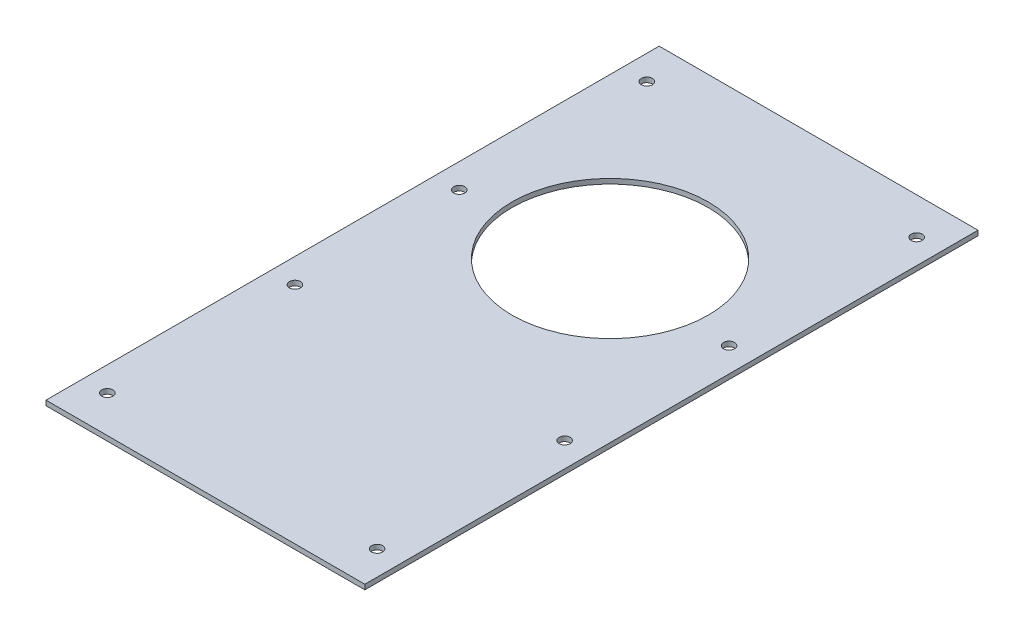
from build123d import *

# Parameters (mm, degrees)
SKETCH_1_W         = 130
SKETCH_1_H         = 250
SKETCH_1_R         = 40
EXTRUDE_1_DEPTH    = 2
HOLE_WIZARD_M4_1_D = 4.5
MIRROR_2_COPY_1_D  = 4.5


with BuildPart() as part:
    # 草图1 → 凸台-拉伸1 (new body)
    with BuildSketch(Plane(origin=(0, 0, 0), x_dir=(1, 0, 0), z_dir=(0, 1, 0))):
        Rectangle(SKETCH_1_W, SKETCH_1_H)
        with Locations(Location((0, 40, 0), (0, 0, 270))):
            Circle(SKETCH_1_R, mode=Mode.SUBTRACT)
    extrude(amount=EXTRUDE_1_DEPTH)

    # M4 间隙孔1 (through all)
    with Locations(Plane(origin=(0, 2, 0), x_dir=(1, 0, 0), z_dir=(0, 1, 0))):
        with Locations((-55, -110), (-55, -33.5)):
            hole_wizard_m4_1 = Hole(HOLE_WIZARD_M4_1_D / 2)

    # 镜向1: M4 间隙孔1 across plane
    add(hole_wizard_m4_1.mirror(Plane.XY), mode=Mode.SUBTRACT)

    # 镜向2: M4 间隙孔1 across plane
    add(hole_wizard_m4_1.mirror(Plane.ZY), mode=Mode.SUBTRACT)

    # 镜向2 copy 1 (through all)
    with Locations(Plane(origin=(0, 2, 0), x_dir=(-1, 0, 0), z_dir=(0, 1, 0))):
        with Locations((-55, -110), (-55, -33.5)):
            Hole(MIRROR_2_COPY_1_D / 2)


solid = part.part
